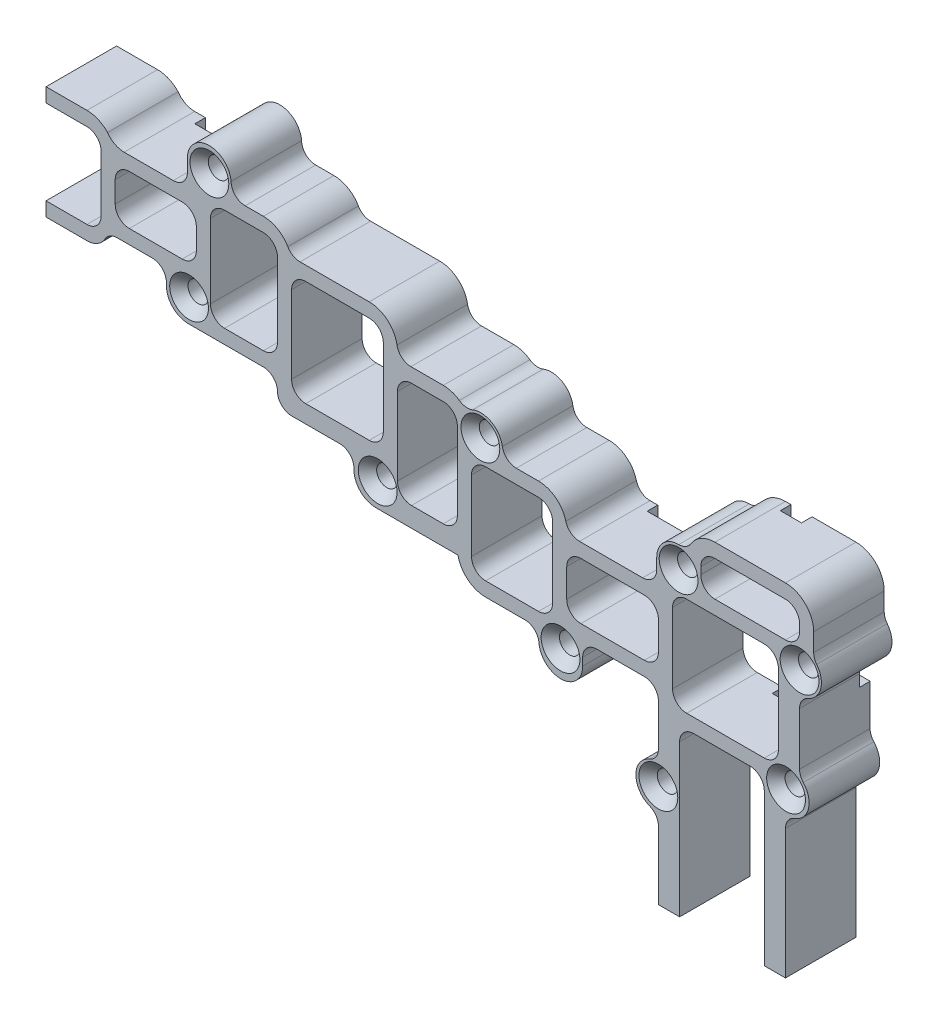
from build123d import *

# Parameters (mm, degrees)
EXTRUDE_1_DEPTH                 = 10
HOLE_WIZARD_M2_51_D             = 2.9
HOLE_WIZARD_M2_51_CSINK_D       = 5.5
HOLE_WIZARD_M2_51_CSINK_ANGLE   = 90
CUT_EXTRUDE_1_REACH             = 117.174
SKETCH_9_W                      = 1.5
SKETCH_9_H                      = 1.8
CUT_EXTRUDE_2_REACH             = 105.395
SKETCH_10_W                     = 1.5
SKETCH_10_H                     = 2.8
CUT_EXTRUDE_3_REACH             = 95.728
SKETCH_11_W                     = 1.5
SKETCH_11_H                     = 4.61050078
CUT_EXTRUDE_5_REACH             = 116.534
SKETCH_12_W                     = 5.79500384
SKETCH_12_H                     = 1.5
CUT_EXTRUDE_6_REACH             = 83.835
SKETCH_13_W                     = 1.5
SKETCH_13_H                     = 5.238699812
CUT_EXTRUDE_6_DIRECTION_2_REACH = 83.835
CUT_EXTRUDE_7_REACH             = 80.99
SKETCH_14_W                     = 1.5
SKETCH_14_H                     = 5.29970024
CUT_EXTRUDE_8_REACH             = 91.419
SKETCH_15_W                     = 1.5
SKETCH_15_H                     = 1.85499896
CUT_EXTRUDE_9_REACH             = 103.857
SKETCH_17_W                     = 1.5
SKETCH_17_H                     = 2.8
CUT_EXTRUDE_10_REACH            = 110.308
SKETCH_18_W                     = 5.78751592
SKETCH_18_H                     = 1.5
CUT_EXTRUDE_11_REACH            = 111.188
SKETCH_19_W                     = 1.80000034
SKETCH_19_H                     = 1.5
CUT_EXTRUDE_12_REACH            = 113.91
SKETCH_20_W                     = 3.00000054
SKETCH_20_H                     = 1.5
CUT_EXTRUDE_13_REACH            = 118.683
SKETCH_21_W                     = 1.5
SKETCH_21_H                     = 2.3400024
CUT_EXTRUDE_14_REACH            = 110.602
SKETCH_22_W                     = 2.8
SKETCH_22_H                     = 1.5


with BuildPart() as part:
    # Эскиз6 → Бобышка-Вытянуть1 (new body)
    with BuildSketch(Plane.XY):
        with BuildLine():
            Line((81.20000086, -9.00000176), (81.20000086, 12.49999824))
            ThreePointArc((81.20000086, 12.49999824), (81.785787298, 13.914211802), (83.20000086, 14.49999824))
            Line((83.20000086, 14.49999824), (91.20000086, 14.49999824))
            ThreePointArc((91.20000086, 14.49999824), (92.614214422, 13.914211802), (93.20000086, 12.49999824))
            Line((93.20000086, 12.49999824), (93.20000086, -9.00000176))
            Line((93.20000086, -9.00000176), (96.20000086, -9.00000176))
            Line((96.20000086, -9.00000176), (96.20000086, 9.366820625))
            ThreePointArc((96.20000086, 9.366820625), (96.561747801, 10.514046373), (97.516127776, 11.246266715))
            ThreePointArc((97.516127776, 11.246266715), (99.468975957, 13.429527292), (98.731814051, 16.264458523))
            ThreePointArc((98.731814051, 16.264458523), (98.337694008, 16.893300305), (98.20000086, 17.622555535))
            Line((98.20000086, 17.622555535), (98.20000086, 25.088270618))
            ThreePointArc((98.20000086, 25.088270618), (98.531374561, 26.190852259), (99.415687135, 26.928067341))
            ThreePointArc((99.415687135, 26.928067341), (101.204160141, 29.014881672), (100.631373409, 31.702881879))
            ThreePointArc((100.631373409, 31.702881879), (100.310919747, 32.286821087), (100.20000086, 32.943610664))
            Line((100.20000086, 32.943610664), (100.20000086, 35.49999824))
            ThreePointArc((100.20000086, 35.49999824), (99.028427985, 38.328425365), (96.20000086, 39.49999824))
            Line((96.20000086, 39.49999824), (86.20000086, 39.49999824))
            ThreePointArc((86.20000086, 39.49999824), (84.24736537, 38.991017381), (82.791656925, 37.593605562))
            ThreePointArc((82.791656925, 37.593605562), (82.058610903, 36.892005839), (81.075597393, 36.640444553))
            ThreePointArc((81.075597393, 36.640444553), (78.871664833, 35.73903516), (77.957171668, 33.540499312))
            Line((77.957171668, 33.540499312), (77.957171668, 31.99999824))
            ThreePointArc((77.957171668, 31.99999824), (77.37138523, 30.585784678), (75.957171668, 29.99999824))
            Line((75.957171668, 29.99999824), (67.009475879, 29.99999824))
            ThreePointArc((67.009475879, 29.99999824), (65.784731008, 30.41885941), (65.072984206, 31.49999824))
            ThreePointArc((65.072984206, 31.49999824), (63.649490603, 33.6622759), (61.20000086, 34.49999824))
            Line((61.20000086, 34.49999824), (58.049746648, 34.49999824))
            ThreePointArc((58.049746648, 34.49999824), (56.752186507, 34.978046309), (56.074922485, 36.183660559))
            ThreePointArc((56.074922485, 36.183660559), (54.543128866, 38.389927001), (51.863412539, 38.571926213))
            ThreePointArc((51.863412539, 38.571926213), (50.895117619, 38.441892277), (49.98075596, 38.786053044))
            ThreePointArc((49.98075596, 38.786053044), (48.894944537, 39.317341506), (47.70000086, 39.49999824))
            Line((47.70000086, 39.49999824), (43.116080643, 39.49999824))
            ThreePointArc((43.116080643, 39.49999824), (41.825086194, 39.972473008), (41.144054049, 41.166664907))
            ThreePointArc((41.144054049, 41.166664907), (39.781989757, 43.555048703), (37.20000086, 44.49999824))
            Line((37.20000086, 44.49999824), (27.396153283, 44.49999824))
            ThreePointArc((27.396153283, 44.49999824), (26.396153283, 44.767947432), (25.664102475, 45.49999824))
            ThreePointArc((25.664102475, 45.49999824), (24.20000086, 46.964099855), (22.20000086, 47.49999824))
            Line((22.20000086, 47.49999824), (19.622055186, 47.49999824))
            ThreePointArc((19.622055186, 47.49999824), (18.208125612, 48.085500746), (17.622055347, 49.49919508))
            ThreePointArc((17.622055347, 49.49919508), (14.407643171, 52.348107474), (11.432038739, 49.250604328))
            Line((11.432038739, 49.250604328), (11.432038739, 47.49999824))
            ThreePointArc((11.432038739, 47.49999824), (10.846252302, 46.085784678), (9.432038739, 45.49999824))
            Line((9.432038739, 45.49999824), (2.472362834, 45.49999824))
            ThreePointArc((2.472362834, 45.49999824), (1.133134911, 45.83192166), (0.10392771, 46.750854261))
            ThreePointArc((0.10392771, 46.750854261), (-1.219401798, 47.674465826), (-2.79999914, 47.99999824))
            Line((-2.79999914, 47.99999824), (-8.59999914, 47.99999824))
            Line((-8.59999914, 47.99999824), (-8.59999914, 45.99999824))
            Line((-8.59999914, 45.99999824), (-2.79999914, 45.99999824))
            ThreePointArc((-2.79999914, 45.99999824), (-1.385785578, 45.414211802), (-0.79999914, 43.99999824))
            Line((-0.79999914, 43.99999824), (-0.79999914, 35.99999824))
            ThreePointArc((-0.79999914, 35.99999824), (-1.385785578, 34.585784678), (-2.79999914, 33.99999824))
            Line((-2.79999914, 33.99999824), (-8.59999914, 33.99999824))
            Line((-8.59999914, 33.99999824), (-8.59999914, 31.99999824))
            Line((-8.59999914, 31.99999824), (-2.79999914, 31.99999824))
            ThreePointArc((-2.79999914, 31.99999824), (-1.32231541, 32.398875435), (-0.246063762, 33.487146823))
            ThreePointArc((-0.246063762, 33.487146823), (0.486938319, 34.228335181), (1.493343515, 34.49999824))
            Line((1.493343515, 34.49999824), (6.460860195, 34.49999824))
            ThreePointArc((6.460860195, 34.49999824), (7.875073757, 33.914211802), (8.460860195, 32.49999824))
            Line((8.460860195, 32.49999824), (8.460860195, 32.09999824))
            ThreePointArc((8.460860195, 32.09999824), (9.368829173, 29.907967218), (11.560860195, 28.99999824))
            Line((11.560860195, 28.99999824), (22.20000086, 28.99999824))
            ThreePointArc((22.20000086, 28.99999824), (23.614214422, 28.414211802), (24.20000086, 26.99999824))
            ThreePointArc((24.20000086, 26.99999824), (24.785787298, 25.585784678), (26.20000086, 24.99999824))
            Line((26.20000086, 24.99999824), (33.041851282, 24.99999824))
            ThreePointArc((33.041851282, 24.99999824), (34.456064844, 24.414211802), (35.041851282, 22.99999824))
            Line((35.041851282, 22.99999824), (35.041851282, 22.79999824))
            ThreePointArc((35.041851282, 22.79999824), (35.94982026, 20.607967218), (38.141851282, 19.69999824))
            Line((38.141851282, 19.69999824), (49.780817272, 19.69999824))
            ThreePointArc((49.780817272, 19.69999824), (51.170178732, 17.401611563), (53.70000086, 16.49999824))
            Line((53.70000086, 16.49999824), (59.273091273, 16.49999824))
            ThreePointArc((59.273091273, 16.49999824), (60.630713184, 15.968624382), (61.266930303, 14.656860985))
            ThreePointArc((61.266930303, 14.656860985), (64.479043159, 11.802386536), (67.4573808, 14.89999824))
            Line((67.4573808, 14.89999824), (67.4573808, 15.99999824))
            ThreePointArc((67.4573808, 15.99999824), (68.043167238, 17.414211802), (69.4573808, 17.99999824))
            Line((69.4573808, 17.99999824), (76.20000086, 17.99999824))
            ThreePointArc((76.20000086, 17.99999824), (77.614214422, 17.414211802), (78.20000086, 15.99999824))
            Line((78.20000086, 15.99999824), (78.20000086, 10.096040906))
            ThreePointArc((78.20000086, 10.096040906), (77.856834599, 8.975816838), (76.945098899, 8.240015876))
            ThreePointArc((76.945098899, 8.240015876), (75.00000086, 5.363177079), (76.945098899, 2.486338283))
            ThreePointArc((76.945098899, 2.486338283), (77.856834599, 1.75053732), (78.20000086, 0.630313253))
            Line((78.20000086, 0.630313253), (78.20000086, -9.00000176))
            Line((78.20000086, -9.00000176), (81.20000086, -9.00000176))
        make_face()
        with BuildLine():
            Line((3.20000086, 43.49999824), (10.70000086, 43.49999824))
            ThreePointArc((10.70000086, 43.49999824), (12.114214422, 42.914211802), (12.70000086, 41.49999824))
            Line((12.70000086, 41.49999824), (12.70000086, 38.49999824))
            ThreePointArc((12.70000086, 38.49999824), (12.114214422, 37.085784678), (10.70000086, 36.49999824))
            Line((10.70000086, 36.49999824), (3.20000086, 36.49999824))
            ThreePointArc((3.20000086, 36.49999824), (1.785787298, 37.085784678), (1.20000086, 38.49999824))
            Line((1.20000086, 38.49999824), (1.20000086, 41.49999824))
            ThreePointArc((1.20000086, 41.49999824), (1.785787298, 42.914211802), (3.20000086, 43.49999824))
        make_face(mode=Mode.SUBTRACT)
        with BuildLine():
            Line((82.20000086, 30.49999824), (93.20000086, 30.49999824))
            ThreePointArc((93.20000086, 30.49999824), (94.614214422, 29.914211802), (95.20000086, 28.49999824))
            Line((95.20000086, 28.49999824), (95.20000086, 18.49999824))
            ThreePointArc((95.20000086, 18.49999824), (94.614214422, 17.085784678), (93.20000086, 16.49999824))
            Line((93.20000086, 16.49999824), (82.20000086, 16.49999824))
            ThreePointArc((82.20000086, 16.49999824), (80.785787298, 17.085784678), (80.20000086, 18.49999824))
            Line((80.20000086, 18.49999824), (80.20000086, 28.49999824))
            ThreePointArc((80.20000086, 28.49999824), (80.785787298, 29.914211802), (82.20000086, 30.49999824))
        make_face(mode=Mode.SUBTRACT)
        with BuildLine():
            Line((86.20000086, 37.49999824), (96.20000086, 37.49999824))
            ThreePointArc((96.20000086, 37.49999824), (97.614214422, 36.914211802), (98.20000086, 35.49999824))
            Line((98.20000086, 35.49999824), (98.20000086, 34.49999824))
            ThreePointArc((98.20000086, 34.49999824), (97.614214422, 33.085784678), (96.20000086, 32.49999824))
            Line((96.20000086, 32.49999824), (86.20000086, 32.49999824))
            ThreePointArc((86.20000086, 32.49999824), (84.785787298, 33.085784678), (84.20000086, 34.49999824))
            Line((84.20000086, 34.49999824), (84.20000086, 35.49999824))
            ThreePointArc((84.20000086, 35.49999824), (84.785787298, 36.914211802), (86.20000086, 37.49999824))
        make_face(mode=Mode.SUBTRACT)
        with BuildLine():
            Line((67.20000086, 27.99999824), (76.20000086, 27.99999824))
            ThreePointArc((76.20000086, 27.99999824), (77.614214422, 27.414211802), (78.20000086, 25.99999824))
            Line((78.20000086, 25.99999824), (78.20000086, 21.99999824))
            ThreePointArc((78.20000086, 21.99999824), (77.614214422, 20.585784678), (76.20000086, 19.99999824))
            Line((76.20000086, 19.99999824), (67.20000086, 19.99999824))
            ThreePointArc((67.20000086, 19.99999824), (65.785787298, 20.585784678), (65.20000086, 21.99999824))
            Line((65.20000086, 21.99999824), (65.20000086, 25.99999824))
            ThreePointArc((65.20000086, 25.99999824), (65.785787298, 27.414211802), (67.20000086, 27.99999824))
        make_face(mode=Mode.SUBTRACT)
        with BuildLine():
            Line((61.20000086, 32.49999824), (53.70000086, 32.49999824))
            ThreePointArc((53.70000086, 32.49999824), (52.285787298, 31.914211802), (51.70000086, 30.49999824))
            Line((51.70000086, 30.49999824), (51.70000086, 20.49999824))
            ThreePointArc((51.70000086, 20.49999824), (52.285787298, 19.085784678), (53.70000086, 18.49999824))
            Line((53.70000086, 18.49999824), (61.20000086, 18.49999824))
            ThreePointArc((61.20000086, 18.49999824), (62.614214422, 19.085784678), (63.20000086, 20.49999824))
            Line((63.20000086, 20.49999824), (63.20000086, 30.49999824))
            ThreePointArc((63.20000086, 30.49999824), (62.614214422, 31.914211802), (61.20000086, 32.49999824))
        make_face(mode=Mode.SUBTRACT)
        with BuildLine():
            Line((43.20000086, 37.49999824), (47.70000086, 37.49999824))
            ThreePointArc((47.70000086, 37.49999824), (49.114214422, 36.914211802), (49.70000086, 35.49999824))
            Line((49.70000086, 35.49999824), (49.70000086, 24.49999824))
            ThreePointArc((49.70000086, 24.49999824), (49.114214422, 23.085784678), (47.70000086, 22.49999824))
            Line((47.70000086, 22.49999824), (43.20000086, 22.49999824))
            ThreePointArc((43.20000086, 22.49999824), (41.785787298, 23.085784678), (41.20000086, 24.49999824))
            Line((41.20000086, 24.49999824), (41.20000086, 35.49999824))
            ThreePointArc((41.20000086, 35.49999824), (41.785787298, 36.914211802), (43.20000086, 37.49999824))
        make_face(mode=Mode.SUBTRACT)
        with BuildLine():
            Line((28.20000086, 42.49999824), (37.20000086, 42.49999824))
            ThreePointArc((37.20000086, 42.49999824), (38.614214422, 41.914211802), (39.20000086, 40.49999824))
            Line((39.20000086, 40.49999824), (39.20000086, 29.49999824))
            ThreePointArc((39.20000086, 29.49999824), (38.614214422, 28.085784678), (37.20000086, 27.49999824))
            Line((37.20000086, 27.49999824), (28.20000086, 27.49999824))
            ThreePointArc((28.20000086, 27.49999824), (26.785787298, 28.085784678), (26.20000086, 29.49999824))
            Line((26.20000086, 29.49999824), (26.20000086, 40.49999824))
            ThreePointArc((26.20000086, 40.49999824), (26.785787298, 41.914211802), (28.20000086, 42.49999824))
        make_face(mode=Mode.SUBTRACT)
        with BuildLine():
            Line((16.70000086, 45.49999824), (22.20000086, 45.49999824))
            ThreePointArc((22.20000086, 45.49999824), (23.614214422, 44.914211802), (24.20000086, 43.49999824))
            Line((24.20000086, 43.49999824), (24.20000086, 32.99999824))
            ThreePointArc((24.20000086, 32.99999824), (23.614214422, 31.585784678), (22.20000086, 30.99999824))
            Line((22.20000086, 30.99999824), (16.70000086, 30.99999824))
            ThreePointArc((16.70000086, 30.99999824), (15.285787298, 31.585784678), (14.70000086, 32.99999824))
            Line((14.70000086, 32.99999824), (14.70000086, 43.49999824))
            ThreePointArc((14.70000086, 43.49999824), (15.285787298, 44.914211802), (16.70000086, 45.49999824))
        make_face(mode=Mode.SUBTRACT)
    extrude(amount=EXTRUDE_1_DEPTH)

    # Отверстие с зазором M2.51 (through all)
    with Locations(Plane.XY.offset(10)):
        with Locations((14.552676738, 48.9918182), (11.673412415, 32.307135082), (38.407901683, 23.093297034), (64.315400785, 15.510970613), (78.189738908, 5.49892165), (96.282490093, 14.234813878), (98.20000086, 29.779752261), (81.057171668, 33.540499312), (52.959520703, 35.665984683)):
            CounterSinkHole(HOLE_WIZARD_M2_51_D / 2, HOLE_WIZARD_M2_51_CSINK_D / 2, counter_sink_angle=HOLE_WIZARD_M2_51_CSINK_ANGLE)

    # Эскиз9 → Вырез-Вытянуть1 (cut, up to next)
    with BuildSketch(Plane.ZY.offset(0.79999914), mode=Mode.PRIVATE) as cut_extrude_1_sk1:
        with Locations((0.75, 39.99999824)):
            Rectangle(SKETCH_9_W, SKETCH_9_H)
    cut_extrude_1_tool1 = extrude(cut_extrude_1_sk1.sketch, amount=-CUT_EXTRUDE_1_REACH, mode=Mode.PRIVATE) & part.part
    add(cut_extrude_1_tool1.solids().sort_by_distance((-0.799999, 39.999998, 0.75))[0], mode=Mode.SUBTRACT)

    # Эскиз10 → Вырез-Вытянуть2 (cut, up to next)
    with BuildSketch(Plane.ZY.offset(-12.70000086), mode=Mode.PRIVATE) as cut_extrude_2_sk1:
        with Locations((0.75, 39.97126499)):
            Rectangle(SKETCH_10_W, SKETCH_10_H)
    cut_extrude_2_tool1 = extrude(cut_extrude_2_sk1.sketch, amount=-CUT_EXTRUDE_2_REACH, mode=Mode.PRIVATE) & part.part
    add(cut_extrude_2_tool1.solids().sort_by_distance((12.700001, 39.971265, 0.75))[0], mode=Mode.SUBTRACT)

    # Эскиз11 → Вырез-Вытянуть3 (cut, up to next)
    with BuildSketch(Plane.ZY.offset(-24.20000086), mode=Mode.PRIVATE) as cut_extrude_3_sk1:
        with Locations((0.75, 36.83914781)):
            Rectangle(SKETCH_11_W, SKETCH_11_H)
    cut_extrude_3_tool1 = extrude(cut_extrude_3_sk1.sketch, amount=-CUT_EXTRUDE_3_REACH, mode=Mode.PRIVATE) & part.part
    add(cut_extrude_3_tool1.solids().sort_by_distance((24.200001, 36.839148, 0.75))[0], mode=Mode.SUBTRACT)

    # Эскиз12 → Вырез-Вытянуть5 (cut, up to next)
    with BuildSketch(Plane.XZ.offset(-43.49999824), mode=Mode.PRIVATE) as cut_extrude_5_sk1:
        with Locations((6.88750972, 0.75)):
            Rectangle(SKETCH_12_W, SKETCH_12_H)
    cut_extrude_5_tool1 = extrude(cut_extrude_5_sk1.sketch, amount=-CUT_EXTRUDE_5_REACH, mode=Mode.PRIVATE) & part.part
    add(cut_extrude_5_tool1.solids().sort_by_distance((6.88751, 43.499998, 0.75))[0], mode=Mode.SUBTRACT)

    # Эскиз13 → Вырез-Вытянуть6 (cut, up to next)
    with BuildSketch(Plane.ZY.offset(-39.20000086), mode=Mode.PRIVATE) as cut_extrude_6_sk1:
        with Locations((0.75, 31.850348174)):
            Rectangle(SKETCH_13_W, SKETCH_13_H)
    cut_extrude_6_tool1 = extrude(cut_extrude_6_sk1.sketch, amount=-CUT_EXTRUDE_6_REACH, mode=Mode.PRIVATE) & part.part
    add(cut_extrude_6_tool1.solids().sort_by_distance((39.200001, 31.850348, 0.75))[0], mode=Mode.SUBTRACT)

    # Эскиз13 → Вырез-Вытянуть6 direction 2 (cut, up to next)
    with BuildSketch(Plane.ZY.offset(-39.20000086), mode=Mode.PRIVATE) as cut_extrude_6_direction_2_sk1:
        with Locations((0.75, 31.850348174)):
            Rectangle(SKETCH_13_W, SKETCH_13_H)
    cut_extrude_6_direction_2_tool1 = extrude(cut_extrude_6_direction_2_sk1.sketch, amount=CUT_EXTRUDE_6_DIRECTION_2_REACH, mode=Mode.PRIVATE) & part.part
    add(cut_extrude_6_direction_2_tool1.solids().sort_by_distance((39.200001, 31.850348, 0.75))[0], mode=Mode.SUBTRACT)

    # Эскиз14 → Вырез-Вытянуть7 (cut, up to next)
    with BuildSketch(Plane.ZY.offset(-49.70000086), mode=Mode.PRIVATE) as cut_extrude_7_sk1:
        with Locations((0.75, 28.40014974)):
            Rectangle(SKETCH_14_W, SKETCH_14_H)
    cut_extrude_7_tool1 = extrude(cut_extrude_7_sk1.sketch, amount=-CUT_EXTRUDE_7_REACH, mode=Mode.PRIVATE) & part.part
    add(cut_extrude_7_tool1.solids().sort_by_distance((49.700001, 28.40015, 0.75))[0], mode=Mode.SUBTRACT)

    # Эскиз15 → Вырез-Вытянуть8 (cut, up to next)
    with BuildSketch(Plane.ZY.offset(-63.20000086), mode=Mode.PRIVATE) as cut_extrude_8_sk1:
        with Locations((0.75, 23.84999802)):
            Rectangle(SKETCH_15_W, SKETCH_15_H)
    cut_extrude_8_tool1 = extrude(cut_extrude_8_sk1.sketch, amount=-CUT_EXTRUDE_8_REACH, mode=Mode.PRIVATE) & part.part
    add(cut_extrude_8_tool1.solids().sort_by_distance((63.200001, 23.849998, 0.75))[0], mode=Mode.SUBTRACT)

    # Эскиз17 → Вырез-Вытянуть9 (cut, up to next)
    with BuildSketch(Plane.ZY.offset(-78.20000086), mode=Mode.PRIVATE) as cut_extrude_9_sk1:
        with Locations((0.75, 23.842142839)):
            Rectangle(SKETCH_17_W, SKETCH_17_H)
    cut_extrude_9_tool1 = extrude(cut_extrude_9_sk1.sketch, amount=-CUT_EXTRUDE_9_REACH, mode=Mode.PRIVATE) & part.part
    add(cut_extrude_9_tool1.solids().sort_by_distance((78.200001, 23.842143, 0.75))[0], mode=Mode.SUBTRACT)

    # Эскиз18 → Вырез-Вытянуть10 (cut, up to next)
    with BuildSketch(Plane.XZ.offset(-27.99999824), mode=Mode.PRIVATE) as cut_extrude_10_sk1:
        with Locations((71.0000104, 0.75)):
            Rectangle(SKETCH_18_W, SKETCH_18_H)
    cut_extrude_10_tool1 = extrude(cut_extrude_10_sk1.sketch, amount=-CUT_EXTRUDE_10_REACH, mode=Mode.PRIVATE) & part.part
    add(cut_extrude_10_tool1.solids().sort_by_distance((71.00001, 27.999998, 0.75))[0], mode=Mode.SUBTRACT)

    # Эскиз19 → Вырез-Вытянуть11 (cut, up to next)
    with BuildSketch(Plane(origin=(0, 30.49999824, 0), x_dir=(-1, 0, 0), z_dir=(0, -1, 0)), mode=Mode.PRIVATE) as cut_extrude_11_sk1:
        with Locations((-87.97488374, -0.75)):
            Rectangle(SKETCH_19_W, SKETCH_19_H)
    cut_extrude_11_tool1 = extrude(cut_extrude_11_sk1.sketch, amount=-CUT_EXTRUDE_11_REACH, mode=Mode.PRIVATE) & part.part
    add(cut_extrude_11_tool1.solids().sort_by_distance((87.974884, 30.499998, 0.75))[0], mode=Mode.SUBTRACT)

    # Эскиз20 → Вырез-Вытянуть12 (cut, up to next)
    with BuildSketch(Plane.XZ.offset(-37.49999824), mode=Mode.PRIVATE) as cut_extrude_12_sk1:
        with Locations((88.47488655, 0.75)):
            Rectangle(SKETCH_20_W, SKETCH_20_H)
    cut_extrude_12_tool1 = extrude(cut_extrude_12_sk1.sketch, amount=-CUT_EXTRUDE_12_REACH, mode=Mode.PRIVATE) & part.part
    add(cut_extrude_12_tool1.solids().sort_by_distance((88.474887, 37.499998, 0.75))[0], mode=Mode.SUBTRACT)

    # Эскиз21 → Вырез-Вытянуть13 (cut, up to next)
    with BuildSketch(Plane.ZY.offset(-95.20000086), mode=Mode.PRIVATE) as cut_extrude_13_sk1:
        with Locations((0.75, 24.59999906)):
            Rectangle(SKETCH_21_W, SKETCH_21_H)
    cut_extrude_13_tool1 = extrude(cut_extrude_13_sk1.sketch, amount=-CUT_EXTRUDE_13_REACH, mode=Mode.PRIVATE) & part.part
    add(cut_extrude_13_tool1.solids().sort_by_distance((95.200001, 24.599999, 0.75))[0], mode=Mode.SUBTRACT)

    # Эскиз22 → Вырез-Вытянуть14 (cut, up to next)
    with BuildSketch(Plane.XZ.offset(-14.49999824), mode=Mode.PRIVATE) as cut_extrude_14_sk1:
        with Locations((87.238335762, 0.75)):
            Rectangle(SKETCH_22_W, SKETCH_22_H)
    cut_extrude_14_tool1 = extrude(cut_extrude_14_sk1.sketch, amount=-CUT_EXTRUDE_14_REACH, mode=Mode.PRIVATE) & part.part
    add(cut_extrude_14_tool1.solids().sort_by_distance((87.238336, 14.499998, 0.75))[0], mode=Mode.SUBTRACT)


solid = part.part
